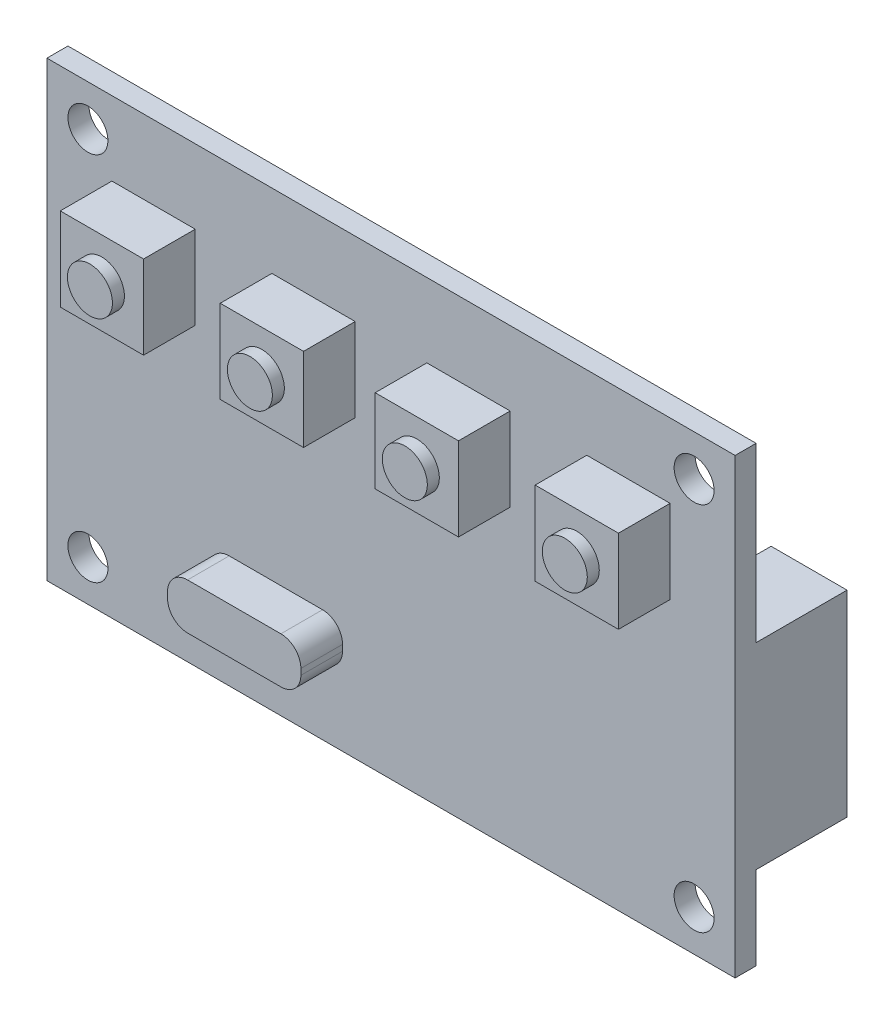
from build123d import *

# Parameters (mm, degrees)
SKETCH1_W           = 52.451
SKETCH1_H           = 34.4932
SKETCH1_R           = 1.524
BOSS_EXTRUDE1_DEPTH = 1.6002
SKETCH2_W           = 6.35
SKETCH2_H           = 6.35
BOSS_EXTRUDE2_DEPTH = 3.937
BOSS_EXTRUDE3_DEPTH = 3.175
SKETCH4_W           = 5.7912
SKETCH4_H           = 14.986
SKETCH4_H_2         = 12.446
BOSS_EXTRUDE4_DEPTH = 6.9342
SKETCH5_W           = 5.08
SKETCH5_H           = 12.7
BOSS_EXTRUDE5_DEPTH = 11.938
SKETCH6_R           = 1.7145
BOSS_EXTRUDE6_DEPTH = 0.9144


with BuildPart() as part:
    # Sketch1 → Boss-Extrude1 (new body)
    with BuildSketch(Plane.XY):
        Rectangle(SKETCH1_W, SKETCH1_H)
        with Locations((23.1013, 14.1224)):
            Circle(SKETCH1_R, mode=Mode.SUBTRACT)
        with Locations(Location((23.1013, -14.1224, 0), (0, 0, 180))):
            Circle(SKETCH1_R, mode=Mode.SUBTRACT)
        with Locations((-23.1013, -14.1224)):
            Circle(SKETCH1_R, mode=Mode.SUBTRACT)
        with Locations(Location((-23.1013, 14.1224, 0), (0, 0, 180))):
            Circle(SKETCH1_R, mode=Mode.SUBTRACT)
    extrude(amount=BOSS_EXTRUDE1_DEPTH)

    # Sketch2 → Boss-Extrude2 (add)
    with BuildSketch(Plane.XY.offset(1.6002)):
        with Locations((-18.0975, 8.4328)):
            Rectangle(SKETCH2_W, SKETCH2_H)
        with Locations((-5.9055, 8.4328)):
            Rectangle(SKETCH2_W, SKETCH2_H)
        with Locations((18.0975, 8.4328)):
            Rectangle(SKETCH2_W, SKETCH2_H)
        with Locations((5.9055, 8.4328)):
            Rectangle(SKETCH2_W, SKETCH2_H)
    extrude(amount=BOSS_EXTRUDE2_DEPTH)

    # Sketch3 → Boss-Extrude3 (add)
    with BuildSketch(Plane.XY.offset(1.6002)):
        with BuildLine():
            Line((-12.3317, -8.6614), (-5.2197, -8.6614))
            ThreePointArc((-5.2197, -8.6614), (-4.142069265, -9.107769265), (-3.6957, -10.1854))
            Line((-3.6957, -10.1854), (-3.6957, -10.6426))
            ThreePointArc((-3.6957, -10.6426), (-4.142069265, -11.720230735), (-5.2197, -12.1666))
            Line((-5.2197, -12.1666), (-12.3317, -12.1666))
            ThreePointArc((-12.3317, -12.1666), (-13.409330735, -11.720230735), (-13.8557, -10.6426))
            Line((-13.8557, -10.6426), (-13.8557, -10.1854))
            ThreePointArc((-13.8557, -10.1854), (-13.409330735, -9.107769265), (-12.3317, -8.6614))
        make_face()
    extrude(amount=BOSS_EXTRUDE3_DEPTH)

    # Sketch4 → Boss-Extrude4 (add)
    with BuildSketch(Plane(origin=(0, 0, 0), x_dir=(-1, 0, 0), z_dir=(0, 0, -1))):
        with Locations((-23.3299, -3.4036)):
            Rectangle(SKETCH4_W, SKETCH4_H)
        with Locations((23.3299, 1.9812)):
            Rectangle(SKETCH4_W, SKETCH4_H_2)
    extrude(amount=BOSS_EXTRUDE4_DEPTH)

    # Sketch5 → Boss-Extrude5 (add)
    with BuildSketch(Plane(origin=(0, 0, 0), x_dir=(-1, 0, 0), z_dir=(0, 0, -1))):
        with Locations((9.7155, -1.0668)):
            Rectangle(SKETCH5_W, SKETCH5_H)
    extrude(amount=BOSS_EXTRUDE5_DEPTH)

    # Sketch6 → Boss-Extrude6 (add)
    with BuildSketch(Plane.XY.offset(5.5372)):
        with Locations((-18.0975, 8.4328)):
            Circle(SKETCH6_R)
        with Locations((-5.9055, 8.4328)):
            Circle(SKETCH6_R)
        with Locations((5.9055, 8.4328)):
            Circle(SKETCH6_R)
        with Locations((18.0975, 8.4328)):
            Circle(SKETCH6_R)
    extrude(amount=BOSS_EXTRUDE6_DEPTH)


solid = part.part
